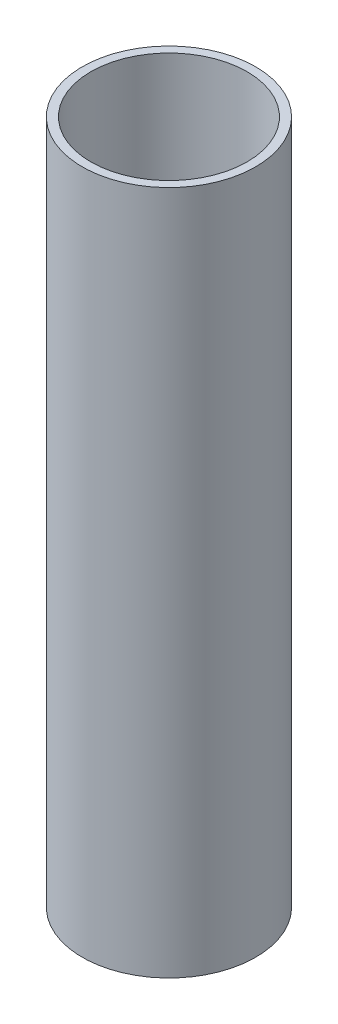
from build123d import *

# Parameters (mm, degrees)
SKETCH1_R           = 19.304
BOSS_EXTRUDE1_DEPTH = 76.2
SKETCH2_R           = 17.399
CUT_EXTRUDE1_DEPTH  = 155.825866159


with BuildPart() as part:
    # Sketch1 → Boss-Extrude1 (new, symmetric)
    with BuildSketch(Plane(origin=(0, 0, 0), x_dir=(1, 0, 0), z_dir=(0, 1, 0))):
        with Locations(Location((0, 0, 0), (0, 0, 90))):
            Circle(SKETCH1_R)
    extrude(amount=BOSS_EXTRUDE1_DEPTH, both=True)

    # Sketch2 → Cut-Extrude1 (cut, through all)
    with BuildSketch(Plane(origin=(0, 76.2, 0), x_dir=(1, 0, 0), z_dir=(0, 1, 0))):
        with Locations(Location((0, 0, 0), (0, 0, 270))):
            Circle(SKETCH2_R)
    extrude(amount=-CUT_EXTRUDE1_DEPTH, mode=Mode.SUBTRACT)


solid = part.part
